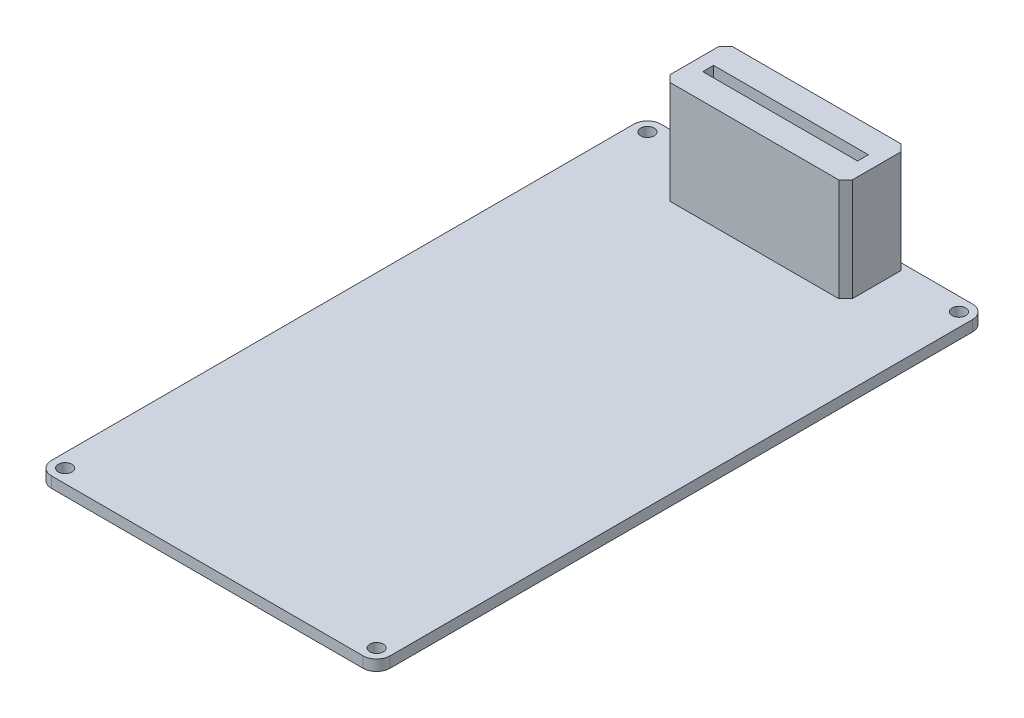
from build123d import *

# Parameters (mm, degrees)
SKETCH_1_R          = 1
EXTRUDE_1_DEPTH     = 1.6
EXTRUDE_START       = 1.6
SKETCH_2_W          = 26.92
SKETCH_2_H          = 9.2
EXTRUDE_2_DEPTH     = 15.2
CUT_EXTRUDE_START   = 16.8
SKETCH_3_W          = 22.86
SKETCH_3_H          = 1.6
CUT_EXTRUDE_1_DEPTH = 9
CUT_EXTRUDE_START_2 = -45
SKETCH_4_W          = 26.92
SKETCH_4_H          = 1
CUT_EXTRUDE_2_DEPTH = 0.1
CUT_EXTRUDE_START_3 = 1.6
CUT_EXTRUDE_3_DEPTH = 15.2


with BuildPart() as part:
    # 草图1 → 凸台-拉伸1 (new body)
    with BuildSketch(Plane(origin=(0, 0, 0), x_dir=(1, 0, 0), z_dir=(0, 1, 0))):
        with BuildLine():
            Line((-23, 45), (23, 45))
            ThreePointArc((23, 45), (24.414213562, 44.414213562), (25, 43))
            Line((25, 43), (25, -43))
            ThreePointArc((25, -43), (24.414213562, -44.414213562), (23, -45))
            Line((23, -45), (-23, -45))
            ThreePointArc((-23, -45), (-24.414213562, -44.414213562), (-25, -43))
            Line((-25, -43), (-25, 43))
            ThreePointArc((-25, 43), (-24.414213562, 44.414213562), (-23, 45))
        make_face()
        with Locations(Location((-23, 43, 0), (0, 0, 270))):
            Circle(SKETCH_1_R, mode=Mode.SUBTRACT)
        with Locations(Location((23, 43, 0), (0, 0, 270))):
            Circle(SKETCH_1_R, mode=Mode.SUBTRACT)
        with Locations(Location((-23, -43, 0), (0, 0, 270))):
            Circle(SKETCH_1_R, mode=Mode.SUBTRACT)
        with Locations(Location((23, -43, 0), (0, 0, 270))):
            Circle(SKETCH_1_R, mode=Mode.SUBTRACT)
    extrude(amount=EXTRUDE_1_DEPTH)

    # 草图2 → 凸台-拉伸2 (add)
    with BuildSketch(Plane(origin=(0, 0, 0), x_dir=(1, 0, 0), z_dir=(0, 1, 0)).offset(EXTRUDE_START)):
        with Locations((0, 40.4)):
            Rectangle(SKETCH_2_W, SKETCH_2_H)
    extrude(amount=EXTRUDE_2_DEPTH)

    # 草图3 → 切除-拉伸1 (cut)
    with BuildSketch(Plane(origin=(0, 0, 0), x_dir=(1, 0, 0), z_dir=(0, 1, 0)).offset(CUT_EXTRUDE_START)):
        with Locations((0, 40.4)):
            Rectangle(SKETCH_3_W, SKETCH_3_H)
    extrude(amount=-CUT_EXTRUDE_1_DEPTH, mode=Mode.SUBTRACT)

    # 草图4 → 切除-拉伸2 (cut)
    with BuildSketch(Plane.XY.offset(CUT_EXTRUDE_START_2)):
        with Locations((0, 2.1)):
            Rectangle(SKETCH_4_W, SKETCH_4_H)
    extrude(amount=CUT_EXTRUDE_2_DEPTH, mode=Mode.SUBTRACT)

    # 草图5 → 切除-拉伸3 (cut)
    with BuildSketch(Plane(origin=(0, 0, 0), x_dir=(1, 0, 0), z_dir=(0, 1, 0)).offset(CUT_EXTRUDE_START_3)):
        Polygon((13.46, 35.8), (13.46, 36.8), (12.46, 35.8), align=None)
        Polygon((13.46, 45), (13.46, 44), (12.46, 45), align=None)
        Polygon((-13.46, 45), (-13.46, 44), (-12.46, 45), align=None)
        Polygon((-13.46, 35.8), (-12.46, 35.8), (-13.46, 36.8), align=None)
    extrude(amount=CUT_EXTRUDE_3_DEPTH, mode=Mode.SUBTRACT)


solid = part.part
